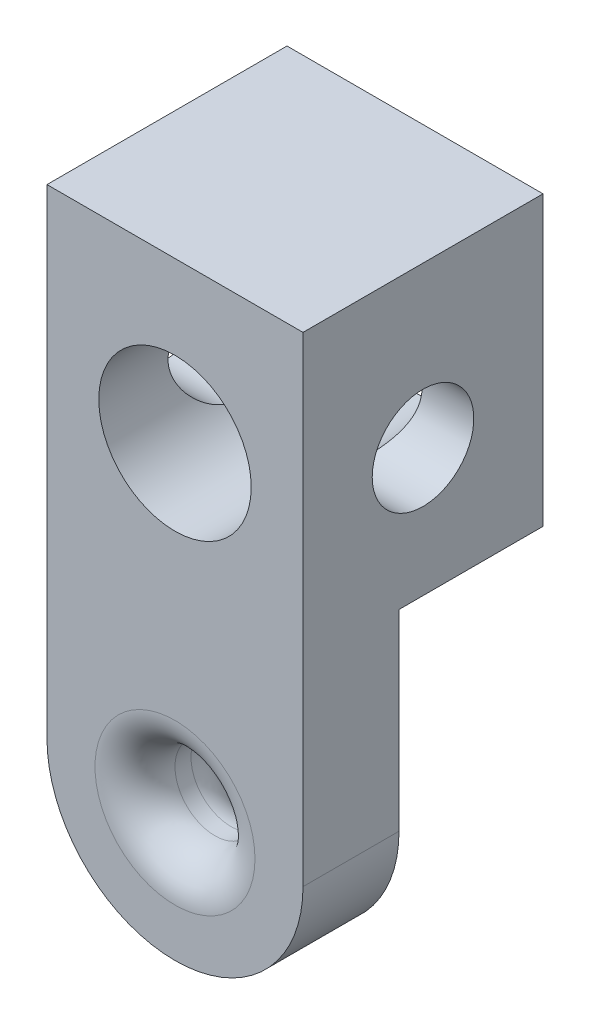
from build123d import *

# Parameters (mm, degrees)
SKETCH1_R                  = 2.5
BOSS_EXTRUDE1_DEPTH        = 15
SKETCH6_W                  = 16
SKETCH6_H                  = 20
CUT_EXTRUDE1_DEPTH         = 9
FILLET1_R                  = 2.5
F_3_8_0_3750_DOWEL_HOLE1_D = 9.525
F_1_4_0_2500_DOWEL_HOLE2_D = 6.35


with BuildPart() as part:
    # Sketch1 → Boss-Extrude1 (new body)
    with BuildSketch(Plane.XY):
        with BuildLine():
            Line((-8, 12), (-8, 0))
            ThreePointArc((-8, 0), (0, -8), (8, 0))
            Line((8, 0), (8, 12))
            Line((8, 12), (8, 30))
            Line((8, 30), (-8, 30))
            Line((-8, 30), (-8, 12))
        make_face()
        Circle(SKETCH1_R, mode=Mode.SUBTRACT)
    extrude(amount=BOSS_EXTRUDE1_DEPTH)

    # Sketch6 → Cut-Extrude1 (cut)
    with BuildSketch(Plane.XY):
        with Locations((0, 2)):
            Rectangle(SKETCH6_W, SKETCH6_H)
    extrude(amount=CUT_EXTRUDE1_DEPTH, mode=Mode.SUBTRACT)

    # Fillet1
    fillet1_edges = [part.edges().sort_by_distance(p)[0] for p in [
        (-2.5, 0, 15),
        (-2.5, 0, 9),
    ]]
    fillet(fillet1_edges, radius=FILLET1_R)

    # 3/8 (0.3750) Dowel Hole1 (through all)
    with Locations(Plane.XY.offset(15)):
        with Locations((0, 20)):
            Hole(F_3_8_0_3750_DOWEL_HOLE1_D / 2)

    # 1/4 (0.2500) Dowel Hole2 (through all)
    with Locations(Plane.ZY.offset(8)):
        with Locations((7.5, 20)):
            Hole(F_1_4_0_2500_DOWEL_HOLE2_D / 2)


solid = part.part
